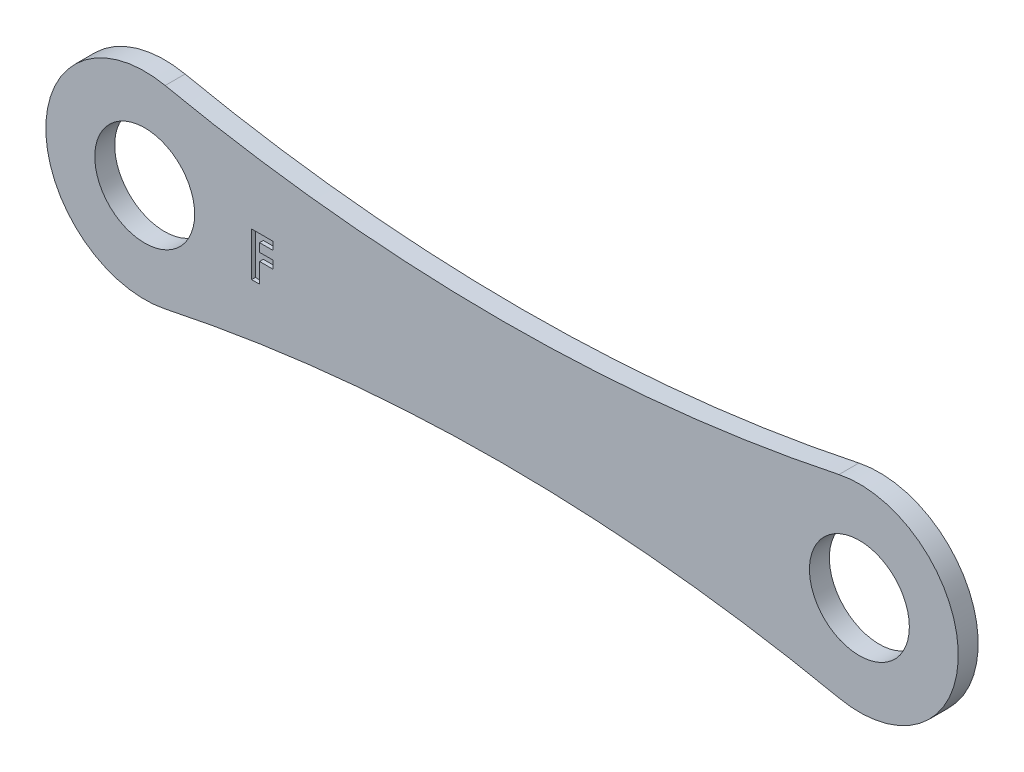
from build123d import *

# Parameters (mm, degrees)
ESQUISSE1_R             = 3.985
BOSS_EXTRU_1_DEPTH      = 1.588
ENL_V_MAT_EXTRU_1_DEPTH = 0.3


with BuildPart() as part:
    # Esquisse1 → Boss.-Extru.1 (new body)
    with BuildSketch(Plane(origin=(0, 0, 0), x_dir=(0, 1, 0), z_dir=(0, 0, 1))):
        with BuildLine():
            ThreePointArc((7.719512097, 55.388671405), (0, 64.91), (-7.719512097, 55.388671405))
            ThreePointArc((-7.719512097, 55.388671405), (-4.910459194, 28.51), (-7.719512097, 1.631328595))
            ThreePointArc((-7.719512097, 1.631328595), (0, -7.89), (7.719512097, 1.631328595))
            ThreePointArc((7.719512097, 1.631328595), (4.910459194, 28.51), (7.719512097, 55.388671405))
        make_face()
        with Locations(Location((0, 57.02, 0), (0, 0, 270))):
            Circle(ESQUISSE1_R, mode=Mode.SUBTRACT)
        with Locations(Location((0, 0, 0), (0, 0, 270))):
            Circle(ESQUISSE1_R, mode=Mode.SUBTRACT)
    extrude(amount=BOSS_EXTRU_1_DEPTH)

    # Esquisse2 → Enlèv. mat.-Extru.1 (cut)
    with BuildSketch(Plane.XY.offset(1.588)):
        Polygon((-48.486058889, 1.258368718), (-46.780930684, 1.258368718), (-46.780930684, 0.63016359), (-47.857853761, 0.63016359), (-47.857853761, -0.042913333), (-46.780930684, -0.042913333), (-46.780930684, -0.671118461), (-47.857853761, -0.671118461), (-47.857853761, -2.241631282), (-48.486058889, -2.241631282), align=None)
    extrude(amount=-ENL_V_MAT_EXTRU_1_DEPTH, mode=Mode.SUBTRACT)


solid = part.part
